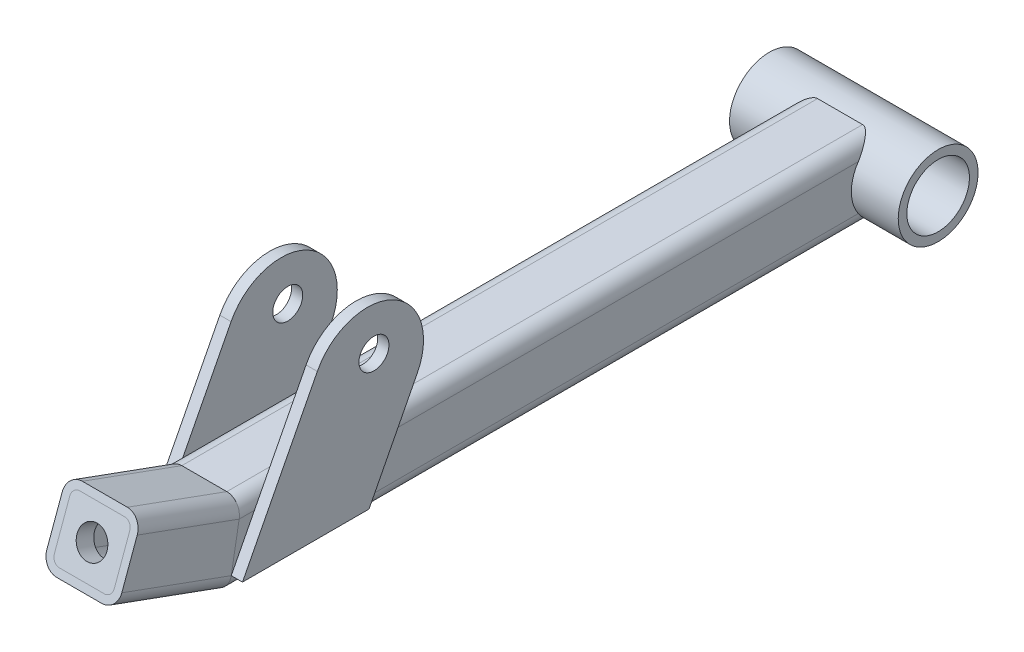
from build123d import *

# Parameters (mm, degrees)
SQUARE_TUBE_20_X_20_X_2_1_DEPTH   = 178.493640075
SQUARE_TUBE_20_X_20_X_2_1_2_DEPTH = 33.493640075
SKETCH15_R                        = 10.65
SKETCH15_R_2                      = 8.35
PIPE_21_3_X_2_3_1_DEPTH           = 45
SKETCH16_R                        = 4
BOSS_EXTRUDE1_DEPTH               = 3
SKETCH17_R                        = 4
BOSS_EXTRUDE2_DEPTH               = 3
SKETCH18_R                        = 4
BOSS_EXTRUDE3_DEPTH               = 5


with BuildPart() as part:
    # Sketch14 → Square tube 20 X 20 X 2(1) (new body)
    with BuildSketch(Plane.XY):
        with BuildLine():
            Line((-6, -10), (6, -10))
            ThreePointArc((6, -10), (8.828427125, -8.828427125), (10, -6))
            Line((10, -6), (10, 6))
            ThreePointArc((10, 6), (8.828427125, 8.828427125), (6, 10))
            Line((6, 10), (-6, 10))
            ThreePointArc((-6, 10), (-8.828427125, 8.828427125), (-10, 6))
            Line((-10, 6), (-10, -6))
            ThreePointArc((-10, -6), (-8.828427125, -8.828427125), (-6, -10))
        make_face()
        with BuildLine():
            Line((-6, -8), (6, -8))
            ThreePointArc((6, -8), (7.414213562, -7.414213562), (8, -6))
            Line((8, -6), (8, 6))
            ThreePointArc((8, 6), (7.414213562, 7.414213562), (6, 8))
            Line((6, 8), (-6, 8))
            ThreePointArc((-6, 8), (-7.414213562, 7.414213562), (-8, 6))
            Line((-8, 6), (-8, -6))
            ThreePointArc((-8, -6), (-7.414213562, -7.414213562), (-6, -8))
        make_face(mode=Mode.SUBTRACT)
    extrude(amount=SQUARE_TUBE_20_X_20_X_2_1_DEPTH)

    # Square tube 20 X 20 X 2(1) mitre 1
    split(bisect_by=Plane(origin=(0, 0, 175), x_dir=(0, 0.984807753, -0.173648178), z_dir=(0, -0.173648178, -0.984807753)), keep=Keep.TOP)


with BuildPart() as body_2:
    # Sketch14 on segment 2 (carried to segment 2) → Square tube 20 X 20 X 2_1 2 (new body)
    with BuildSketch(Plane(origin=(0, -1.194895279, 171.717052202), x_dir=(1, 0, 0), z_dir=(0, 0.342020143, 0.939692621))):
        with BuildLine():
            Line((-6, -10), (6, -10))
            ThreePointArc((6, -10), (8.828427125, -8.828427125), (10, -6))
            Line((10, -6), (10, 6))
            ThreePointArc((10, 6), (8.828427125, 8.828427125), (6, 10))
            Line((6, 10), (-6, 10))
            ThreePointArc((-6, 10), (-8.828427125, 8.828427125), (-10, 6))
            Line((-10, 6), (-10, -6))
            ThreePointArc((-10, -6), (-8.828427125, -8.828427125), (-6, -10))
        make_face()
        with BuildLine():
            Line((-6, -8), (6, -8))
            ThreePointArc((6, -8), (7.414213562, -7.414213562), (8, -6))
            Line((8, -6), (8, 6))
            ThreePointArc((8, 6), (7.414213562, 7.414213562), (6, 8))
            Line((6, 8), (-6, 8))
            ThreePointArc((-6, 8), (-7.414213562, 7.414213562), (-8, 6))
            Line((-8, 6), (-8, -6))
            ThreePointArc((-8, -6), (-7.414213562, -7.414213562), (-6, -8))
        make_face(mode=Mode.SUBTRACT)
    extrude(amount=SQUARE_TUBE_20_X_20_X_2_1_2_DEPTH)

    # Square tube 20 X 20 X 2_1 2 mitre 1
    split(bisect_by=Plane(origin=(0, 0, 175), x_dir=(0, -0.984807753, 0.173648178), z_dir=(0, 0.173648178, 0.984807753)), keep=Keep.TOP)


with BuildPart() as body_3:
    # Sketch15 → Pipe 21.3 X 2.3(1) (new body)
    with BuildSketch(Plane(origin=(-22.5, 0, 0), x_dir=(0, 0, -1), z_dir=(1, 0, 0))):
        Circle(SKETCH15_R)
        Circle(SKETCH15_R_2, mode=Mode.SUBTRACT)
    extrude(amount=PIPE_21_3_X_2_3_1_DEPTH)


with BuildPart() as part_1:
    add(part.part)

    # Trim/Extend1: cut back where it meets the other member's skin (coped)
    split(bisect_by=body_3.part.faces().sort_by_distance((0, 0, 10.65))[0], keep=Keep.TOP)


with BuildPart() as body_4:
    # Sketch16 → Boss-Extrude1 (new body)
    with BuildSketch(Plane.ZY.offset(10)):
        with BuildLine():
            Line((176.057961884, -6), (156.100051786, 32.692198121))
            ThreePointArc((156.100051786, 32.692198121), (135.89271229, 39.146919686), (129.437990725, 18.939580189))
            Line((129.437990725, 18.939580189), (142.302131908, -6))
            Line((142.302131908, -6), (176.057961884, -6))
        make_face()
        with Locations((140.987329124, 29.27003764)):
            Circle(SKETCH16_R, mode=Mode.SUBTRACT)
    extrude(amount=BOSS_EXTRUDE1_DEPTH)


with BuildPart() as body_5:
    # Sketch17 → Boss-Extrude2 (new body)
    with BuildSketch(Plane(origin=(10, 0, 0), x_dir=(0, 0, -1), z_dir=(1, 0, 0))):
        with BuildLine():
            Line((-156.100051786, 32.692198121), (-176.057961884, -6))
            Line((-176.057961884, -6), (-142.302131908, -6))
            Line((-142.302131908, -6), (-129.437990725, 18.939580189))
            ThreePointArc((-129.437990725, 18.939580189), (-135.89271229, 39.146919686), (-156.100051786, 32.692198121))
        make_face()
        with Locations((-140.987329124, 29.27003764)):
            Circle(SKETCH17_R, mode=Mode.SUBTRACT)
    extrude(amount=BOSS_EXTRUDE2_DEPTH)


with BuildPart() as body_6:
    # Sketch18 → Boss-Extrude3 (new body)
    with BuildSketch(Plane(origin=(0, 66.504520147, 182.719667396), x_dir=(1, 0, 0), z_dir=(0, 0.3420201433256697, 0.9396926207859081))):
        with BuildLine():
            Line((8, -65.853525082), (8, -53.853525082))
            ThreePointArc((8, -53.853525082), (7.414213562, -52.43931152), (6, -51.853525082))
            Line((6, -51.853525082), (-6, -51.853525082))
            ThreePointArc((-6, -51.853525082), (-7.414213562, -52.43931152), (-8, -53.853525082))
            Line((-8, -53.853525082), (-8, -65.853525082))
            ThreePointArc((-8, -65.853525082), (-7.414213562, -67.267738644), (-6, -67.853525082))
            Line((-6, -67.853525082), (6, -67.853525082))
            ThreePointArc((6, -67.853525082), (7.414213562, -67.267738644), (8, -65.853525082))
        make_face()
        with Locations(Location((0, -59.853525082, 0), (0, 0, 270))):
            Circle(SKETCH18_R, mode=Mode.SUBTRACT)
    extrude(amount=-BOSS_EXTRUDE3_DEPTH)


solid = Compound([body_2.part, body_3.part, part_1.part, body_4.part, body_5.part, body_6.part])
